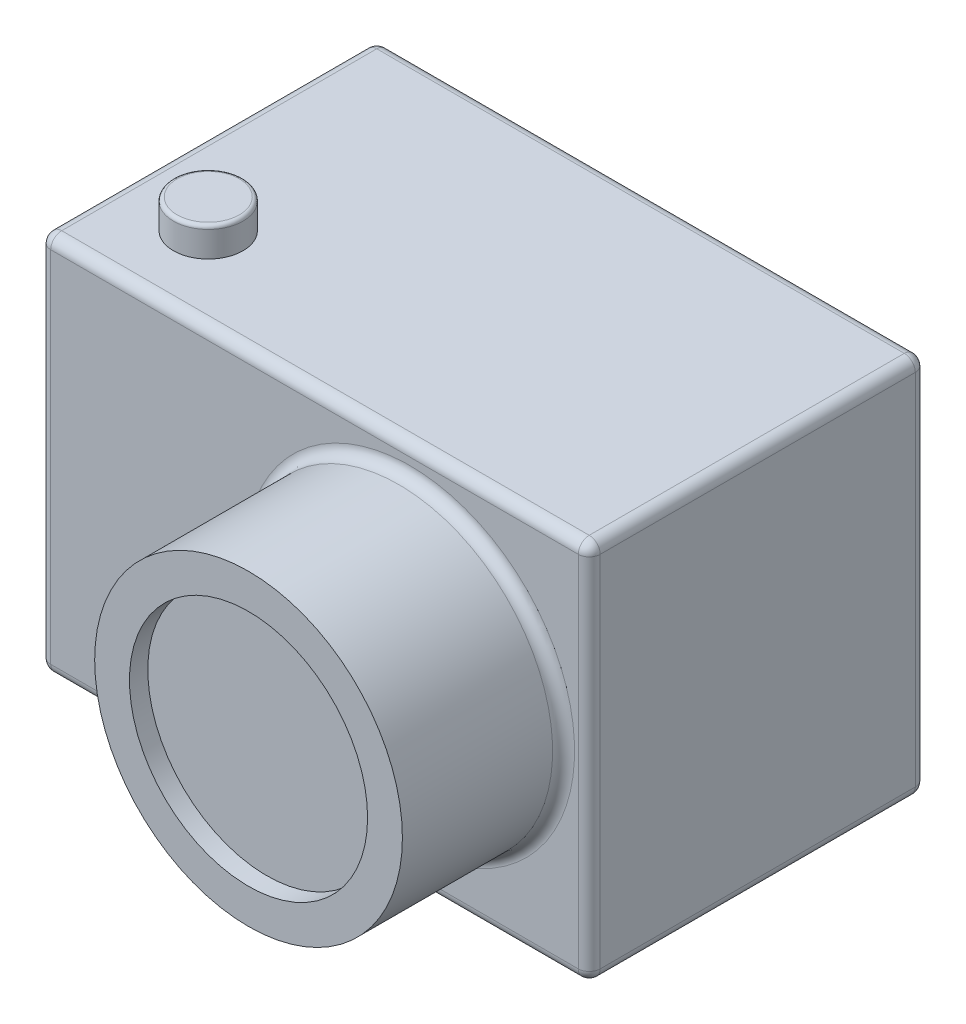
from build123d import *

# Parameters (mm, degrees)
SKETCH1_W           = 150
SKETCH1_H           = 104
BOSS_EXTRUDE1_DEPTH = 92
SKETCH2_R           = 42
BOSS_EXTRUDE2_DEPTH = 44
FILLET1_R           = 3
FILLET2_R           = 3
SKETCH5_R           = 9.5
BOSS_EXTRUDE3_DEPTH = 8
FILLET3_R           = 1
SKETCH6_R           = 32.5
CUT_EXTRUDE1_DEPTH  = 5


with BuildPart() as part:
    # Sketch1 → Boss-Extrude1 (new body)
    with BuildSketch(Plane.XY):
        with Locations((75, 52)):
            Rectangle(SKETCH1_W, SKETCH1_H)
    extrude(amount=-BOSS_EXTRUDE1_DEPTH)

    # Sketch2 → Boss-Extrude2 (add)
    with BuildSketch(Plane.XY):
        with Locations((101, 54)):
            Circle(SKETCH2_R)
    extrude(amount=BOSS_EXTRUDE2_DEPTH)

    # Fillet1
    fillet1_edges = [part.edges().sort_by_distance(p)[0] for p in [
        (150, 52, -92),
        (75, 104, -92),
        (0, 52, -92),
        (75, 104, 0),
        (150, 52, 0),
        (75, 0, 0),
        (0, 52, 0),
        (0, 104, -46),
        (150, 104, -46),
        (150, 0, -46),
        (0, 0, -46),
        (75, 0, -92),
    ]]
    fillet(fillet1_edges, radius=FILLET1_R)

    # Fillet2
    fillet2_edges = [part.edges().sort_by_distance(p)[0] for p in [
        (59, 54, 0),
    ]]
    fillet(fillet2_edges, radius=FILLET2_R)

    # Sketch5 → Boss-Extrude3 (add)
    with BuildSketch(Plane(origin=(0, 104, 0), x_dir=(1, 0, 0), z_dir=(0, 1, 0))):
        with Locations(Location((23, 23, 0), (0, 0, 270))):
            Circle(SKETCH5_R)
    extrude(amount=BOSS_EXTRUDE3_DEPTH)

    # Fillet3
    fillet3_edges = [part.edges().sort_by_distance(p)[0] for p in [
        (23, 112, -32.5),
    ]]
    fillet(fillet3_edges, radius=FILLET3_R)

    # Sketch6 → Cut-Extrude1 (cut)
    with BuildSketch(Plane.XY.offset(44)):
        with Locations((101, 54)):
            Circle(SKETCH6_R)
    extrude(amount=-CUT_EXTRUDE1_DEPTH, mode=Mode.SUBTRACT)


solid = part.part
